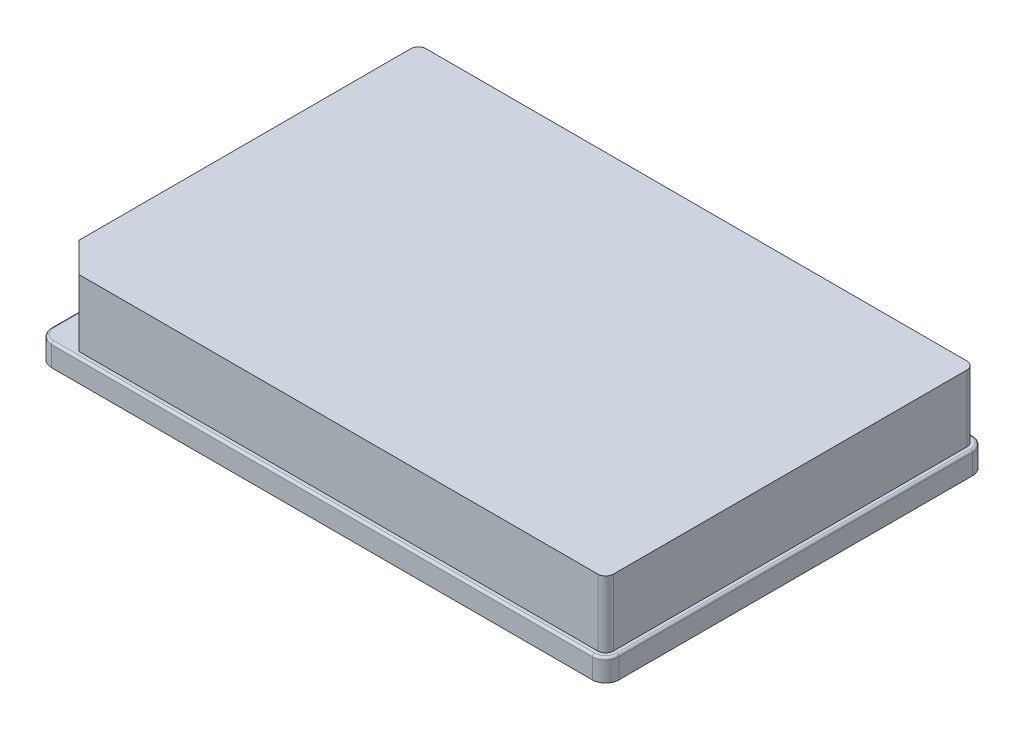
from build123d import *

# Parameters (mm, degrees)
SKETCH1_W           = 127.75
SKETCH1_H           = 85.6
BOSS_EXTRUDE1_DEPTH = 20
FILLET1_R           = 3
CUT_EXTRUDE2_DEPTH  = 15
FILLET5_R           = 0.5


with BuildPart() as part:
    # Sketch1 → Boss-Extrude1 (new body)
    with BuildSketch(Plane(origin=(0, 0, 0), x_dir=(1, 0, 0), z_dir=(0, 1, 0))):
        Rectangle(SKETCH1_W, SKETCH1_H)
    extrude(amount=BOSS_EXTRUDE1_DEPTH)

    # Fillet1
    fillet1_edges = [part.edges().sort_by_distance(p)[0] for p in [
        (-63.875, 10, -42.8),
        (63.875, 10, -42.8),
        (63.875, 10, 42.8),
        (-63.875, 10, 42.8),
    ]]
    fillet(fillet1_edges, radius=FILLET1_R)

    # Sketch3 → Cut-Extrude2 (cut)
    with BuildSketch(Plane(origin=(0, 20, 0), x_dir=(1, 0, 0), z_dir=(0, 1, 0))):
        with BuildLine():
            Line((-63.875, 39.8), (-63.875, -39.8))
            ThreePointArc((-63.875, -39.8), (-62.996320344, -41.921320344), (-60.875, -42.8))
            Line((-60.875, -42.8), (60.875, -42.8))
            ThreePointArc((60.875, -42.8), (62.996320344, -41.921320344), (63.875, -39.8))
            Line((63.875, -39.8), (63.875, 39.8))
            ThreePointArc((63.875, 39.8), (62.996320344, 41.921320344), (60.875, 42.8))
            Line((60.875, 42.8), (-60.875, 42.8))
            ThreePointArc((-60.875, 42.8), (-62.996320344, 41.921320344), (-63.875, 39.8))
        make_face()
        with BuildLine():
            Line((-62.625, 39.8), (-62.625, -34.8))
            Line((-62.625, -34.8), (-55.875, -41.55))
            Line((-55.875, -41.55), (60.875, -41.55))
            ThreePointArc((60.875, -41.55), (62.112436867, -41.037436867), (62.625, -39.8))
            Line((62.625, -39.8), (62.625, 39.8))
            ThreePointArc((62.625, 39.8), (62.112436867, 41.037436867), (60.875, 41.55))
            Line((60.875, 41.55), (-60.875, 41.55))
            ThreePointArc((-60.875, 41.55), (-62.112436867, 41.037436867), (-62.625, 39.8))
        make_face(mode=Mode.SUBTRACT)
    extrude(amount=-CUT_EXTRUDE2_DEPTH, mode=Mode.SUBTRACT)

    # Fillet5
    fillet5_edges = [part.edges().sort_by_distance(p)[0] for p in [
        (-62.996320344, 5, -41.921320344),
        (0, 5, -42.8),
        (62.996320344, 5, -41.921320344),
        (63.875, 5, 0),
        (62.996320344, 5, 41.921320344),
        (0, 5, 42.8),
        (-62.996320344, 5, 41.921320344),
        (-63.875, 5, 0),
    ]]
    fillet(fillet5_edges, radius=FILLET5_R)


solid = part.part
